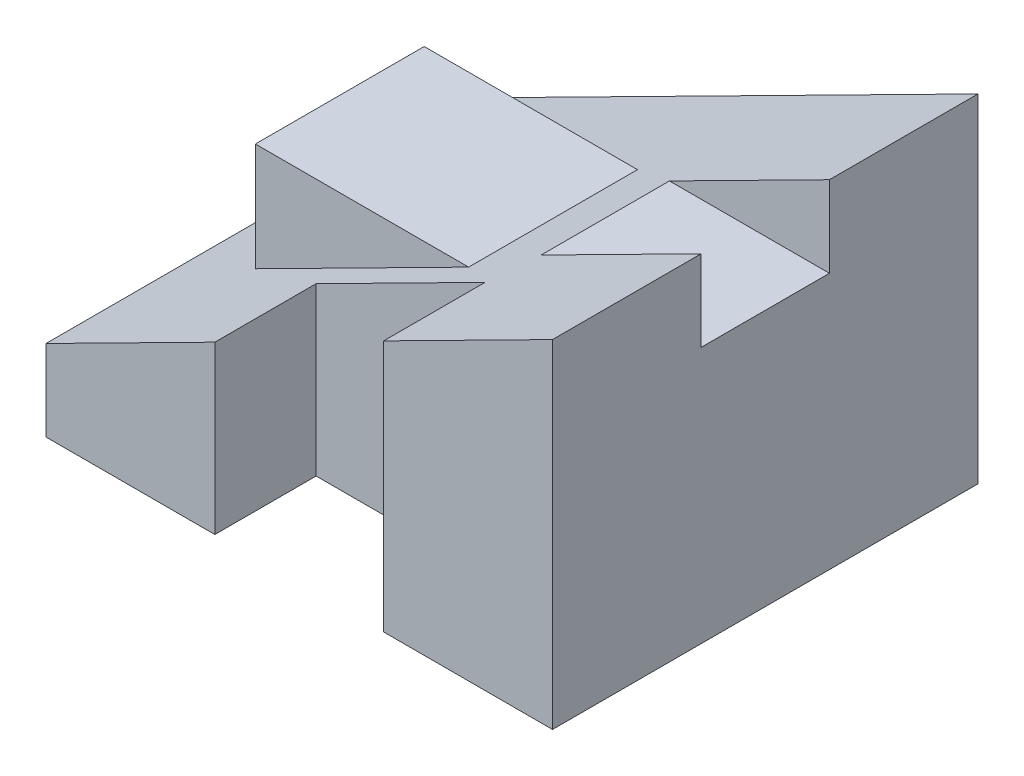
from build123d import *

# Parameters (mm, degrees)
BOSS_EXTRUDE2_DEPTH = 63
CUT_EXTRUDE1_DEPTH  = 15
BOSS_EXTRUDE4_START = -19
BOSS_EXTRUDE4_DEPTH = 25
BOSS_EXTRUDE5_START = -22
BOSS_EXTRUDE5_DEPTH = 19
CUT_EXTRUDE2_START  = -22
CUT_EXTRUDE2_DEPTH  = 19


with BuildPart() as part:
    # Sketch1 → Boss-Extrude2 (new body)
    with BuildSketch(Plane.XY):
        Polygon((0, 12), (0, 0), (75, 0), (75, 50), align=None)
    extrude(amount=-BOSS_EXTRUDE2_DEPTH)

    # Sketch1<5> → Cut-Extrude1 (cut)
    with BuildSketch(Plane.XY):
        Polygon((25, 24.666666667), (25, 0), (50, 0), (50, 37.333333333), (43.578947368, 34.08), align=None)
    extrude(amount=-CUT_EXTRUDE1_DEPTH, mode=Mode.SUBTRACT)

    # Sketch1<7> → Boss-Extrude4 (add)
    with BuildSketch(Plane.XY.offset(BOSS_EXTRUDE4_START)):
        Polygon((12, 18.08), (25, 24.666666667), (43.578947368, 34.08), (12, 34.08), align=None)
    extrude(amount=-BOSS_EXTRUDE4_DEPTH)

    # Sketch1<8> → Boss-Extrude5 (add)
    with BuildSketch(Plane.XY.offset(BOSS_EXTRUDE5_START)):
        Polygon((51.315789474, 38), (75, 38), (75, 50), align=None)
    extrude(amount=-BOSS_EXTRUDE5_DEPTH)

    # Sketch1<9> → Cut-Extrude2 (cut)
    with BuildSketch(Plane.XY.offset(CUT_EXTRUDE2_START)):
        Polygon((51.315789474, 38), (75, 38), (75, 50), align=None)
    extrude(amount=-CUT_EXTRUDE2_DEPTH, mode=Mode.SUBTRACT)


solid = part.part
